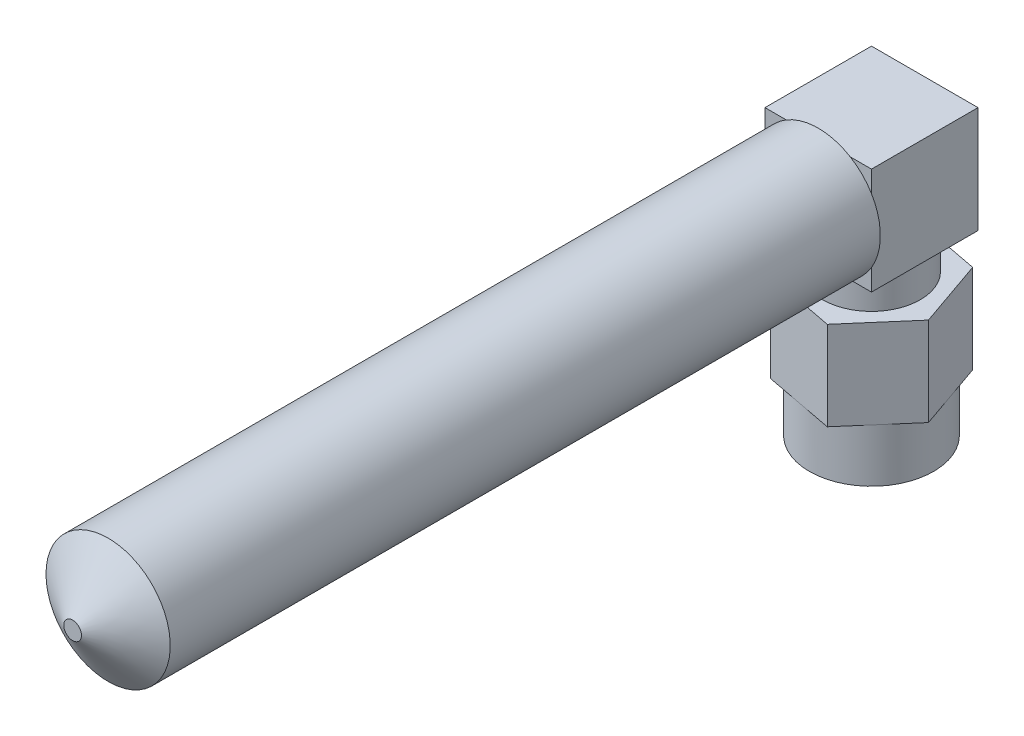
from build123d import *

# Parameters (mm, degrees)
SKETCH_1_R          = 3.5
EXTRUDE_1_DEPTH     = 3
EXTRUDE_2_DEPTH     = 5
SKETCH_3_R          = 2.75
EXTRUDE_3_DEPTH     = 2
SKETCH_4_R          = 2.5
CUT_EXTRUDE_1_DEPTH = 5
SKETCH_5_W          = 6
SKETCH_5_H          = 6
EXTRUDE_4_DEPTH     = 6
SKETCH_6_R          = 3.5
EXTRUDE_7_DEPTH     = 40


with BuildPart() as part:
    # 草图1 → 凸台-拉伸1 (new body)
    with BuildSketch(Plane(origin=(0, 0, 0), x_dir=(1, 0, 0), z_dir=(0, 1, 0))):
        with Locations(Location((0, 0, 0), (0, 0, 270))):
            Circle(SKETCH_1_R)
    extrude(amount=EXTRUDE_1_DEPTH)

    # 草图2 → 凸台-拉伸2 (add)
    with BuildSketch(Plane(origin=(0, 3, 0), x_dir=(1, 0, 0), z_dir=(0, 1, 0))):
        Polygon((2.642653224, 3.057730738), (-1.326745885, 3.817470195), (-3.96939911, 0.759739456), (-2.642653224, -3.057730738), (1.326745885, -3.817470195), (3.96939911, -0.759739456), align=None)
    extrude(amount=EXTRUDE_2_DEPTH)

    # 草图3 → 凸台-拉伸3 (add)
    with BuildSketch(Plane(origin=(0, 8, 0), x_dir=(1, 0, 0), z_dir=(0, 1, 0))):
        with Locations(Location((0, 0, 0), (0, 0, 270))):
            Circle(SKETCH_3_R)
    extrude(amount=EXTRUDE_3_DEPTH)

    # 草图4 → 切除-拉伸1 (cut)
    with BuildSketch(Plane.XZ):
        with Locations(Location((0, 0, 0), (0, 0, 270))):
            Circle(SKETCH_4_R)
    extrude(amount=-CUT_EXTRUDE_1_DEPTH, mode=Mode.SUBTRACT)

    # 草图5 → 凸台-拉伸4 (add)
    with BuildSketch(Plane(origin=(0, 10, 0), x_dir=(1, 0, 0), z_dir=(0, 1, 0))):
        Rectangle(SKETCH_5_W, SKETCH_5_H)
    extrude(amount=EXTRUDE_4_DEPTH)

    # 草图6 → 凸台-拉伸7 (add)
    with BuildSketch(Plane.XY.offset(3)):
        with Locations(Location((0, 13, 0), (0, 0, 148.997280866))):
            Circle(SKETCH_6_R)
    extrude(amount=EXTRUDE_7_DEPTH)

    # 草图7 → 旋转1 (revolve)
    with BuildSketch(Plane(origin=(0, 0, 0), x_dir=(0, 0, -1), z_dir=(1, 0, 0)), mode=Mode.PRIVATE) as revolve_1_sk:
        Polygon((-43, 16.5), (-43, 13), (-45, 13), (-45, 13.5), align=None)
    revolve(revolve_1_sk.sketch.rotate(Axis((0, 13, 43), (0, 0, -1)), 270), axis=Axis((0, 13, 43), (0, 0, -1)))


solid = part.part
